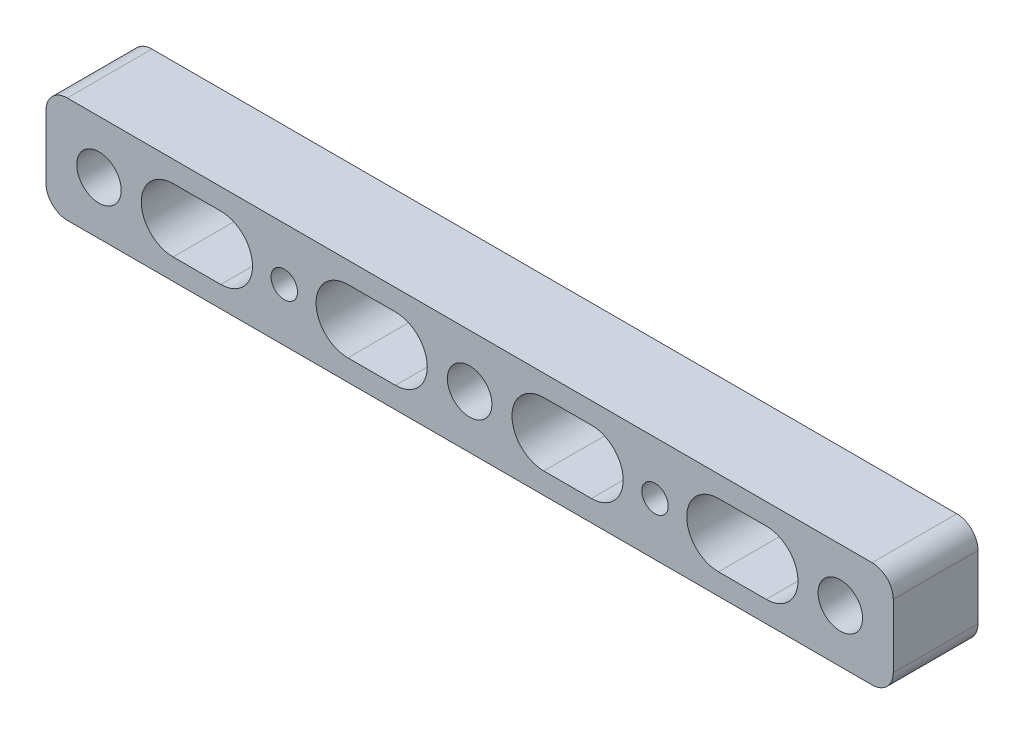
from build123d import *

# Parameters (mm, degrees)
SKETCH_1_W             = 80
SKETCH_1_H             = 10
EXTRUDE_1_DEPTH        = 8
HOLE_WIZARD_M5_1_D     = 4.2
HOLE_WIZARD_M5_1_DEPTH = 12.4
HOLE_WIZARD_M5_1_TIP   = 1.2618073
HOLE_WIZARD_M3_1_D     = 2.5
HOLE_WIZARD_M3_1_DEPTH = 17.5
HOLE_WIZARD_M3_1_TIP   = 0.751075774
FILLET_1_R             = 2
CUT_EXTRUDE_1_DEPTH    = 36


with BuildPart() as part:
    # 草图1 → 凸台-拉伸1 (new body)
    with BuildSketch(Plane.XY):
        Rectangle(SKETCH_1_W, SKETCH_1_H)
    extrude(amount=EXTRUDE_1_DEPTH)

    # M5 螺纹孔1
    with Locations(Plane.XY.offset(8)):
        with Locations((-35, 0), (0, 0), (35, 0)):
            Hole(HOLE_WIZARD_M5_1_D / 2, depth=HOLE_WIZARD_M5_1_DEPTH)
            with Locations((0, 0, -(HOLE_WIZARD_M5_1_DEPTH + HOLE_WIZARD_M5_1_TIP / 2))):  # 118° drill point
                Cone(0, HOLE_WIZARD_M5_1_D / 2, HOLE_WIZARD_M5_1_TIP, mode=Mode.SUBTRACT)

    # M3 螺纹孔1
    with Locations(Plane.XY.offset(8)):
        with Locations((-17.5, 0), (17.5, 0)):
            Hole(HOLE_WIZARD_M3_1_D / 2, depth=HOLE_WIZARD_M3_1_DEPTH)
            with Locations((0, 0, -(HOLE_WIZARD_M3_1_DEPTH + HOLE_WIZARD_M3_1_TIP / 2))):  # 118° drill point
                Cone(0, HOLE_WIZARD_M3_1_D / 2, HOLE_WIZARD_M3_1_TIP, mode=Mode.SUBTRACT)

    # 圆角1
    fillet_1_edges = [part.edges().sort_by_distance(p)[0] for p in [
        (40, -5, 4),
        (-40, -5, 4),
        (-40, 5, 4),
        (40, 5, 4),
    ]]
    fillet(fillet_1_edges, radius=FILLET_1_R)

    # 草图8 → 切除-拉伸1 (cut)
    with BuildSketch(Plane.XY.offset(8)):
        with BuildLine():
            Line((-28, 3), (-23.5, 3))
            ThreePointArc((-23.5, 3), (-20.5, 0), (-23.5, -3))
            Line((-23.5, -3), (-28, -3))
            ThreePointArc((-28, -3), (-31, 0), (-28, 3))
        make_face()
        with BuildLine():
            Line((-7, 3), (-11.5, 3))
            ThreePointArc((-11.5, 3), (-14.5, 0), (-11.5, -3))
            Line((-11.5, -3), (-7, -3))
            ThreePointArc((-7, -3), (-4, 0), (-7, 3))
        make_face()
        with BuildLine():
            Line((7, 3), (11.5, 3))
            ThreePointArc((11.5, 3), (14.5, 0), (11.5, -3))
            Line((11.5, -3), (7, -3))
            ThreePointArc((7, -3), (4, 0), (7, 3))
        make_face()
        with BuildLine():
            Line((28, 3), (23.5, 3))
            ThreePointArc((23.5, 3), (20.5, 0), (23.5, -3))
            Line((23.5, -3), (28, -3))
            ThreePointArc((28, -3), (31, 0), (28, 3))
        make_face()
    extrude(amount=-CUT_EXTRUDE_1_DEPTH, mode=Mode.SUBTRACT)


solid = part.part
